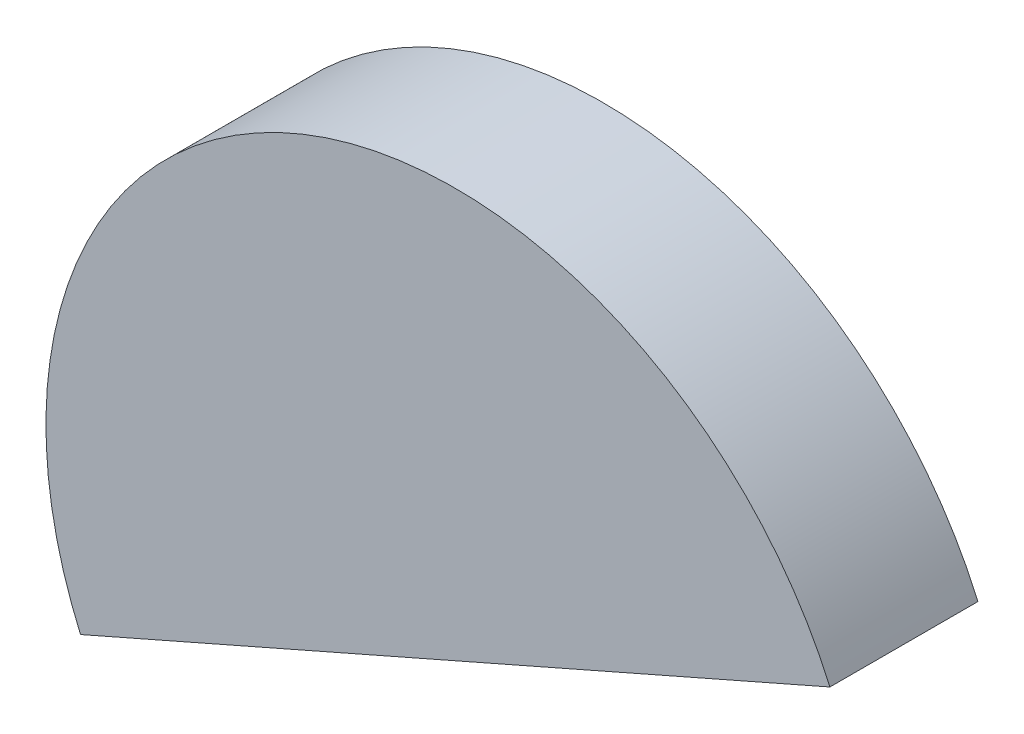
from build123d import *

# Parameters (mm, degrees)
CURVEBOSS_DEPTH = 7.139


with BuildPart() as part:
    # CurveSketch → CurveBoss (new body)
    with BuildSketch(Plane.XY):
        with BuildLine():
            Line((-23.201307673, 5.782177631), (12.927307673, 21.655822369))
            ThreePointArc((12.927307673, 21.655822369), (-13.073822369, 31.783307673), (-23.201307673, 5.782177631))
        make_face()
    extrude(amount=CURVEBOSS_DEPTH)


solid = part.part
